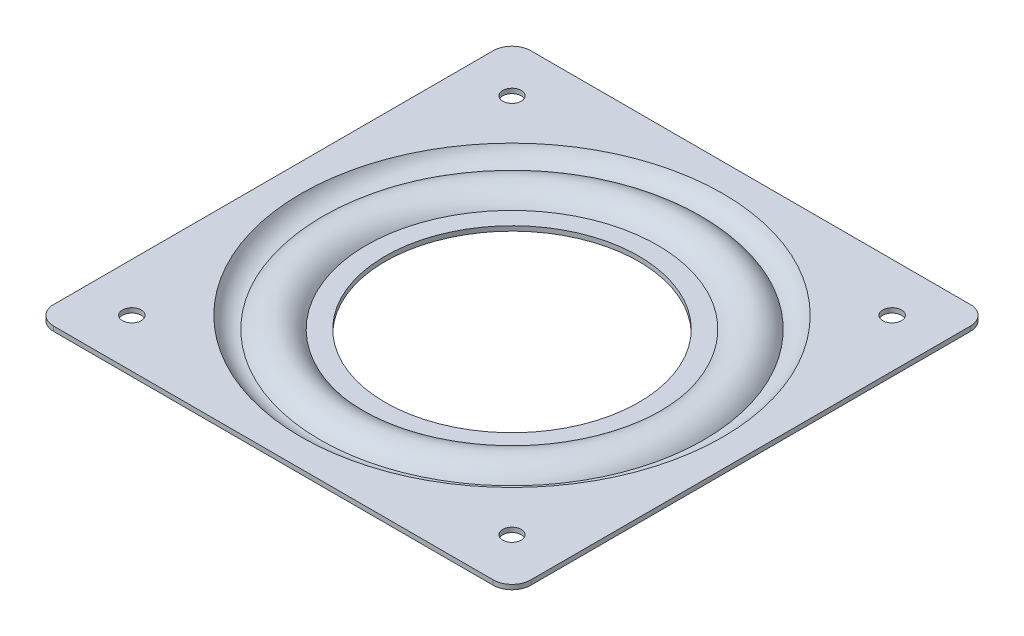
from build123d import *

# Parameters (mm, degrees)
SKETCH_2_R      = 1.985
SKETCH_2_R_2    = 44.910539349
EXTRUDE_1_DEPTH = 1


with BuildPart() as part:
    # 草图1 → 旋转1 (revolve)
    with BuildSketch(Plane.XY, mode=Mode.PRIVATE) as revolve_1_sk:
        with BuildLine():
            ThreePointArc((-45.813874016, -0.428936451), (-43.539426354, -2.86488143), (-40.275857757, -3.540203663))
            ThreePointArc((-40.275857757, -3.540203663), (-35.905809817, -1.000028754), (-31.553091654, -3.569785971))
            Line((-31.553091654, -3.569785971), (-27, -3.569785971))
            Line((-27, -3.569785971), (-27, -2.569785971))
            Line((-27, -2.569785971), (-31, -2.569785971))
            ThreePointArc((-31, -2.569785971), (-35.922766673, 0), (-40.845533346, -2.569785971))
            ThreePointArc((-40.845533346, -2.569785971), (-43.250116145, -1.873465974), (-44.910539349, 0))
            Line((-44.910539349, 0), (-45.813874016, -0.428936451))
        make_face()
    revolve(revolve_1_sk.sketch.rotate(Axis((0, 6.917160425, 0), (0, -1, 0)), 270), axis=Axis((0, 6.917160425, 0), (0, -1, 0)))

    # 草图2 → 凸台-拉伸1 (add)
    with BuildSketch(Plane(origin=(0, 0, 0), x_dir=(1, 0, 0), z_dir=(0, 1, 0))):
        with BuildLine():
            Line((46.8, 50.8), (-46.8, 50.8))
            ThreePointArc((-46.8, 50.8), (-49.628427125, 49.628427125), (-50.8, 46.8))
            Line((-50.8, 46.8), (-50.8, -46.8))
            ThreePointArc((-50.8, -46.8), (-49.628427125, -49.628427125), (-46.8, -50.8))
            Line((-46.8, -50.8), (46.8, -50.8))
            ThreePointArc((46.8, -50.8), (49.628427125, -49.628427125), (50.8, -46.8))
            Line((50.8, -46.8), (50.8, 46.8))
            ThreePointArc((50.8, 46.8), (49.628427125, 49.628427125), (46.8, 50.8))
        make_face()
        with Locations(Location((-40.48, -40.48, 0), (0, 0, 270))):
            Circle(SKETCH_2_R, mode=Mode.SUBTRACT)
        with Locations(Location((40.48, -40.48, 0), (0, 0, 270))):
            Circle(SKETCH_2_R, mode=Mode.SUBTRACT)
        Circle(SKETCH_2_R_2, mode=Mode.SUBTRACT)
        with Locations(Location((-40.48, 40.48, 0), (0, 0, 270))):
            Circle(SKETCH_2_R, mode=Mode.SUBTRACT)
        with Locations(Location((40.48, 40.48, 0), (0, 0, 270))):
            Circle(SKETCH_2_R, mode=Mode.SUBTRACT)
    extrude(amount=-EXTRUDE_1_DEPTH)


solid = part.part
